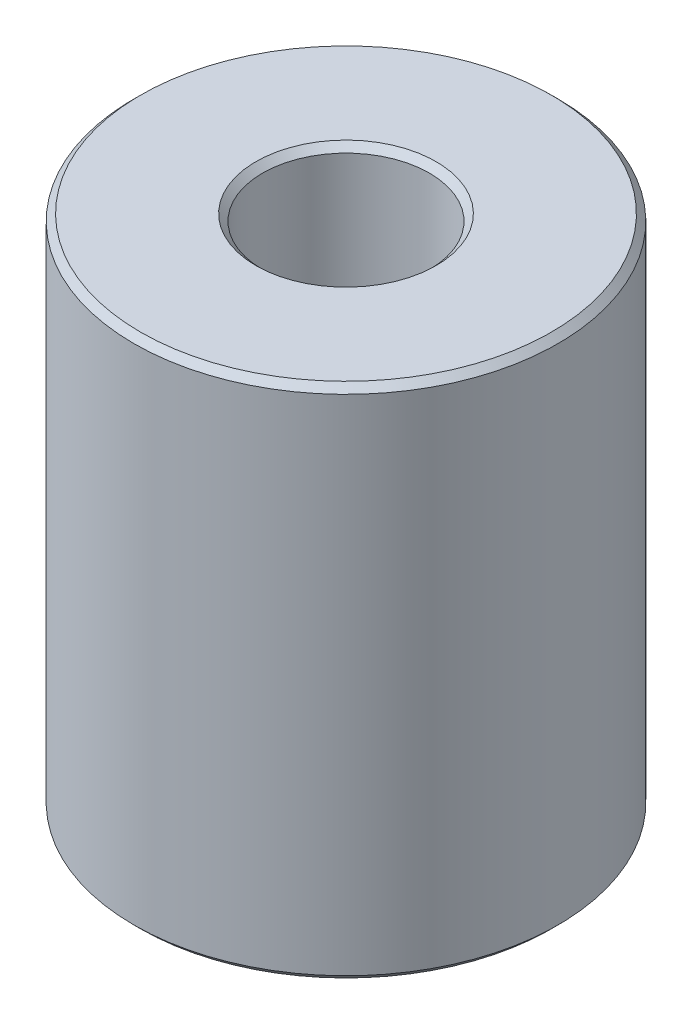
from build123d import *


with BuildPart() as part:
    # Esboço1 → Revolução1 (revolve)
    with BuildSketch(Plane(origin=(0, 0, 0), x_dir=(-1, 0, 0), z_dir=(0, 0, -1)), mode=Mode.PRIVATE) as revolu_o1_sk:
        Polygon((-6.8, 0), (-6.3, 0.5), (-6.3, 38.5), (-6.8, 39), (-15.5, 39), (-16, 38.5), (-16, 0.5), (-15.5, 0), align=None)
    revolve(revolu_o1_sk.sketch.rotate(Axis((0, 0, 0), (0, 1, 0)), 270), axis=Axis((0, 0, 0), (0, 1, 0)))


solid = part.part
